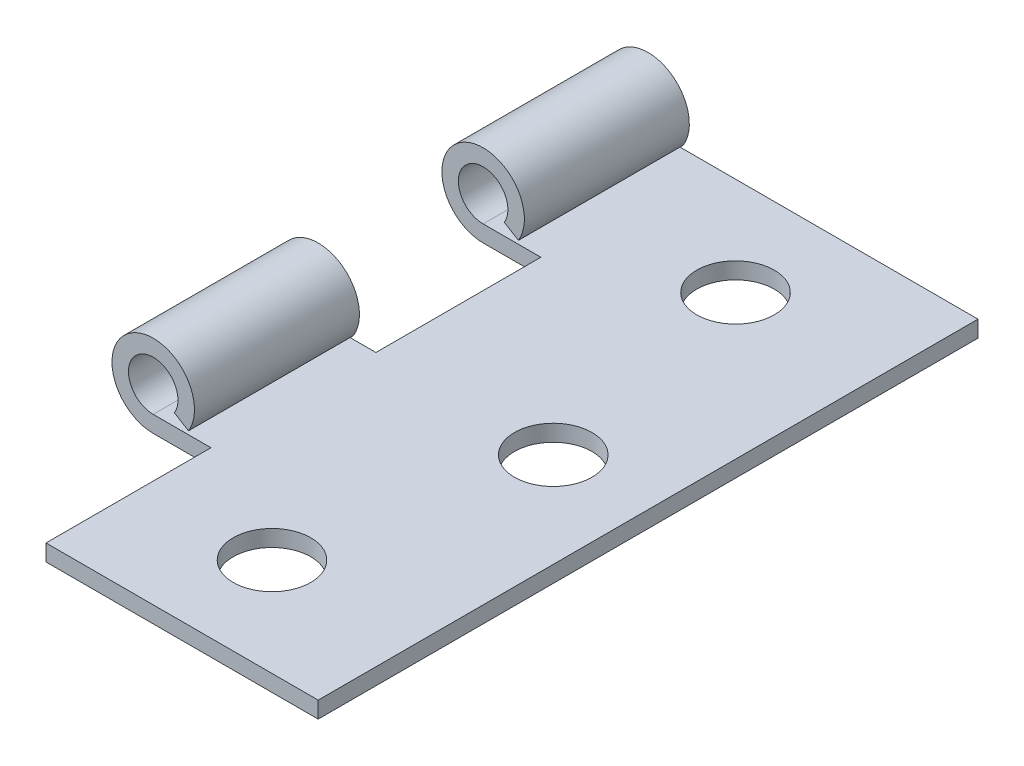
from build123d import *

# Parameters (mm, degrees)
EXTRUDE_THIN2_DEPTH     = 40
CUT_EXTRUDE1_DEPTH      = 45.791182168
CUT_EXTRUDE1_DEPTH_BACK = 45.791182168
SKETCH2_W               = 6
SKETCH2_H               = 10
SKETCH3_R               = 2.35
CUT_EXTRUDE2_DEPTH      = 10


with BuildPart() as part:
    # Sketch1 → Extrude-Thin2 (new body)
    with BuildSketch(Plane.XY):
        with BuildLine():
            Line((20, -1.5), (0, -1.5))
            ThreePointArc((0, -1.5), (-0.736574842, 1.306697173), (1.283307019, -0.776610002))
            Line((1.283307019, -0.776610002), (2.138845031, -1.294350004))
            ThreePointArc((2.138845031, -1.294350004), (-1.227624737, 2.177828622), (0, -2.5))
            Line((0, -2.5), (20, -2.5))
            Line((20, -2.5), (20, -1.5))
        make_face()
    extrude(amount=EXTRUDE_THIN2_DEPTH)

    # Sketch2 → Cut-Extrude1 (cut, two sides: drawn at the far end of the back side and taken through both)
    with BuildSketch(Plane(origin=(0, 0, 0), x_dir=(1, 0, 0), z_dir=(0, 1, 0)).offset(-CUT_EXTRUDE1_DEPTH_BACK)):
        with Locations((0.5, -15)):
            Rectangle(SKETCH2_W, SKETCH2_H)
        with Locations((0.5, -35)):
            Rectangle(SKETCH2_W, SKETCH2_H)
    extrude(amount=CUT_EXTRUDE1_DEPTH + CUT_EXTRUDE1_DEPTH_BACK, mode=Mode.SUBTRACT)

    # Sketch3 → Cut-Extrude2 (cut)
    with BuildSketch(Plane(origin=(0, 0, 0), x_dir=(1, 0, 0), z_dir=(0, 1, 0))):
        with Locations((14.25, -20)):
            Circle(SKETCH3_R)
        with Locations((11.25, -34.05)):
            Circle(SKETCH3_R)
        with Locations((11.25, -5.95)):
            Circle(SKETCH3_R)
    extrude(amount=-CUT_EXTRUDE2_DEPTH, mode=Mode.SUBTRACT)


solid = part.part
